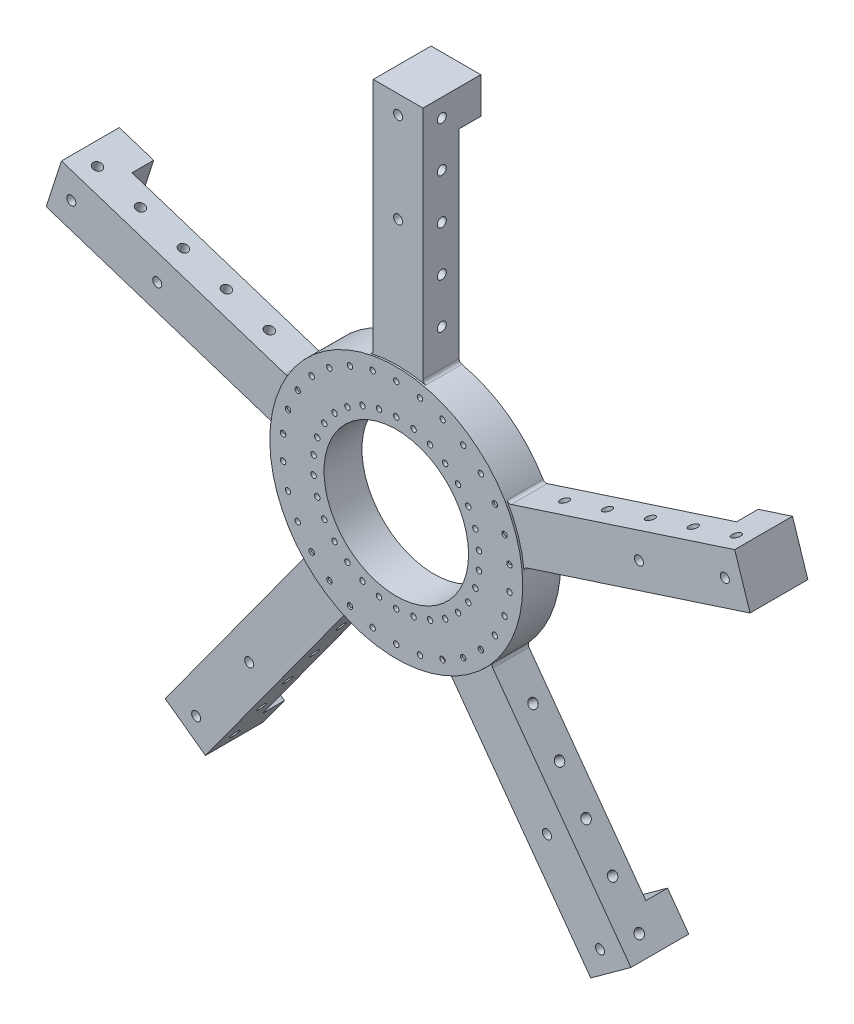
from build123d import *

# Parameters (mm, degrees)
SKETCH1_R                   = 700
SKETCH1_R_2                 = 400
BOSS_EXTRUDE1_DEPTH         = 210
BOSS_EXTRUDE2_START         = 560
SKETCH2_W                   = 275
SKETCH2_H                   = 200
BOSS_EXTRUDE2_DEPTH         = 1443.6
SKETCH3_W                   = 275
SKETCH3_H                   = 200
BOSS_EXTRUDE3_DEPTH         = 120
SKETCH4_R                   = 15
CUT_EXTRUDE1_DEPTH          = 75
CIRPATTERN1_COUNT           = 30
SKETCH6_R                   = 25
CUT_EXTRUDE3_DEPTH          = 75
SKETCH5_R                   = 25
CUT_EXTRUDE2_DEPTH          = 75
FILLET1_R                   = 20
CIRPATTERN2_COUNT           = 5
CIRPATTERN2_COPY_1_SKETCH_R = 25
CIRPATTERN2_COPY_1_DEPTH    = 75
CIRPATTERN2_COPY_2_SKETCH_R = 25
CIRPATTERN2_COPY_2_DEPTH    = 75
CIRPATTERN2_COPY_3_SKETCH_R = 25
CIRPATTERN2_COPY_3_DEPTH    = 75
CIRPATTERN2_COPY_4_SKETCH_R = 25
CIRPATTERN2_COPY_4_DEPTH    = 75
FILLET1_OF_CIRPATTERN2_R    = 20


with BuildPart() as part:
    # Sketch1 → Boss-Extrude1 (new body)
    with BuildSketch(Plane.XY):
        Circle(SKETCH1_R)
        Circle(SKETCH1_R_2, mode=Mode.SUBTRACT)
    extrude(amount=BOSS_EXTRUDE1_DEPTH)

    # Sketch2 → Boss-Extrude2 (add)
    with BuildSketch(Plane(origin=(0, 0, 0), x_dir=(1, 0, 0), z_dir=(0, 1, 0)).offset(BOSS_EXTRUDE2_START)):
        with Locations((0, -100)):
            Rectangle(SKETCH2_W, SKETCH2_H)
    boss_extrude2 = extrude(amount=BOSS_EXTRUDE2_DEPTH)

    # Sketch3 → Boss-Extrude3 (add)
    with BuildSketch(Plane(origin=(0, 0, 0), x_dir=(-1, 0, 0), z_dir=(0, 0, -1))):
        with Locations((0, 1903.6)):
            Rectangle(SKETCH3_W, SKETCH3_H)
    boss_extrude3 = extrude(amount=BOSS_EXTRUDE3_DEPTH)

    # Sketch4 → Cut-Extrude1 (cut)
    with BuildSketch(Plane.XY.offset(210)):
        with Locations((0, 630)):
            Circle(SKETCH4_R)
        with Locations((0, 460)):
            Circle(SKETCH4_R)
    cut_extrude1 = extrude(amount=-CUT_EXTRUDE1_DEPTH, mode=Mode.SUBTRACT)

    # CirPattern1: Cut-Extrude1 ×30 about axis
    cirpattern1_axis = Axis((0, 0, 0), (0, 0, 1))
    for i in range(1, CIRPATTERN1_COUNT):
        add(cut_extrude1.rotate(cirpattern1_axis, i * 360 / CIRPATTERN1_COUNT), mode=Mode.SUBTRACT)

    # Sketch6 → Cut-Extrude3 (cut)
    with BuildSketch(Plane.ZY.offset(137.5)):
        with Locations((95.755617534, 1903.6)):
            Circle(SKETCH6_R)
        with Locations((95.755617534, 1653.6)):
            Circle(SKETCH6_R)
        with Locations((95.755617534, 1403.6)):
            Circle(SKETCH6_R)
        with Locations((95.755617534, 1153.6)):
            Circle(SKETCH6_R)
        with Locations((95.755617534, 903.6)):
            Circle(SKETCH6_R)
    cut_extrude3 = extrude(amount=-CUT_EXTRUDE3_DEPTH, mode=Mode.SUBTRACT)

    # Sketch5 → Cut-Extrude2 (cut)
    with BuildSketch(Plane.XY.offset(200)):
        with Locations((0, 1901.586149553)):
            Circle(SKETCH5_R)
        with Locations((0, 1401.643397042)):
            Circle(SKETCH5_R)
    cut_extrude2 = extrude(amount=-CUT_EXTRUDE2_DEPTH, mode=Mode.SUBTRACT)

    # Mirror1: Cut-Extrude3 across plane
    add(cut_extrude3.mirror(Plane(origin=(0, 0, 0), x_dir=(0, 0, 1), z_dir=(1, 0, 0))), mode=Mode.SUBTRACT)

    # Fillet1
    fillet1_edges = [part.edges().sort_by_distance(p)[0] for p in [
        (-137.5, 686.362695665, 100),
        (137.5, 686.362695665, 100),
    ]]
    fillet(fillet1_edges, radius=FILLET1_R)

    # CirPattern2: Boss-Extrude2, Boss-Extrude3, Cut-Extrude3, Cut-Extrude2 ×5 about axis
    cirpattern2_axis = Axis((0, 0, 0), (0, 0, 1))
    add([boss_extrude2.rotate(cirpattern2_axis, i * 360 / CIRPATTERN2_COUNT) for i in range(1, CIRPATTERN2_COUNT)])
    add([boss_extrude3.rotate(cirpattern2_axis, i * 360 / CIRPATTERN2_COUNT) for i in range(1, CIRPATTERN2_COUNT)])
    add([cut_extrude3.rotate(cirpattern2_axis, i * 360 / CIRPATTERN2_COUNT) for i in range(1, CIRPATTERN2_COUNT)], mode=Mode.SUBTRACT)
    add([cut_extrude2.rotate(cirpattern2_axis, i * 360 / CIRPATTERN2_COUNT) for i in range(1, CIRPATTERN2_COUNT)], mode=Mode.SUBTRACT)

    # CirPattern2 copy 1 sketch → CirPattern2 copy 1 (cut)
    with BuildSketch(Plane(origin=(42.489836727, 130.770270991, 0), x_dir=(0, 0, 1), z_dir=(0.30901699437494745, 0.9510565162951535, 0))):
        with Locations((95.755617534, -1903.6)):
            Circle(CIRPATTERN2_COPY_1_SKETCH_R)
        with Locations((95.755617534, -1653.6)):
            Circle(CIRPATTERN2_COPY_1_SKETCH_R)
        with Locations((95.755617534, -1403.6)):
            Circle(CIRPATTERN2_COPY_1_SKETCH_R)
        with Locations((95.755617534, -1153.6)):
            Circle(CIRPATTERN2_COPY_1_SKETCH_R)
        with Locations((95.755617534, -903.6)):
            Circle(CIRPATTERN2_COPY_1_SKETCH_R)
    extrude(amount=-CIRPATTERN2_COPY_1_DEPTH, mode=Mode.SUBTRACT)

    # CirPattern2 copy 2 sketch → CirPattern2 copy 2 (cut)
    with BuildSketch(Plane(origin=(-111.239836727, 80.82047219, 0), x_dir=(0, 0, 1), z_dir=(-0.8090169943749473, 0.5877852522924732, 0))):
        with Locations((95.755617534, -1903.6)):
            Circle(CIRPATTERN2_COPY_2_SKETCH_R)
        with Locations((95.755617534, -1653.6)):
            Circle(CIRPATTERN2_COPY_2_SKETCH_R)
        with Locations((95.755617534, -1403.6)):
            Circle(CIRPATTERN2_COPY_2_SKETCH_R)
        with Locations((95.755617534, -1153.6)):
            Circle(CIRPATTERN2_COPY_2_SKETCH_R)
        with Locations((95.755617534, -903.6)):
            Circle(CIRPATTERN2_COPY_2_SKETCH_R)
    extrude(amount=-CIRPATTERN2_COPY_2_DEPTH, mode=Mode.SUBTRACT)

    # CirPattern2 copy 3 sketch → CirPattern2 copy 3 (cut)
    with BuildSketch(Plane(origin=(-111.239836727, -80.82047219, 0), x_dir=(0, 0, 1), z_dir=(-0.8090169943749476, -0.587785252292473, 0))):
        with Locations((95.755617534, -1903.6)):
            Circle(CIRPATTERN2_COPY_3_SKETCH_R)
        with Locations((95.755617534, -1653.6)):
            Circle(CIRPATTERN2_COPY_3_SKETCH_R)
        with Locations((95.755617534, -1403.6)):
            Circle(CIRPATTERN2_COPY_3_SKETCH_R)
        with Locations((95.755617534, -1153.6)):
            Circle(CIRPATTERN2_COPY_3_SKETCH_R)
        with Locations((95.755617534, -903.6)):
            Circle(CIRPATTERN2_COPY_3_SKETCH_R)
    extrude(amount=-CIRPATTERN2_COPY_3_DEPTH, mode=Mode.SUBTRACT)

    # CirPattern2 copy 4 sketch → CirPattern2 copy 4 (cut)
    with BuildSketch(Plane(origin=(42.489836727, -130.770270991, 0), x_dir=(0, 0, 1), z_dir=(0.30901699437494723, -0.9510565162951536, 0))):
        with Locations((95.755617534, -1903.6)):
            Circle(CIRPATTERN2_COPY_4_SKETCH_R)
        with Locations((95.755617534, -1653.6)):
            Circle(CIRPATTERN2_COPY_4_SKETCH_R)
        with Locations((95.755617534, -1403.6)):
            Circle(CIRPATTERN2_COPY_4_SKETCH_R)
        with Locations((95.755617534, -1153.6)):
            Circle(CIRPATTERN2_COPY_4_SKETCH_R)
        with Locations((95.755617534, -903.6)):
            Circle(CIRPATTERN2_COPY_4_SKETCH_R)
    extrude(amount=-CIRPATTERN2_COPY_4_DEPTH, mode=Mode.SUBTRACT)

    # Fillet1 of CirPattern2
    fillet1_of_cirpattern2_edges = [part.edges().sort_by_distance(p)[0] for p in [
        (-695.25955098, 81.327466275, 100),
        (-610.279877527, 342.868008256, 100),
        (-292.194033509, -636.099557288, 100),
        (-514.673706962, -474.458612907, 100),
        (514.673706962, -474.458612907, 100),
        (292.194033509, -636.099557288, 100),
        (610.279877527, 342.868008256, 100),
        (695.25955098, 81.327466275, 100),
    ]]
    fillet(fillet1_of_cirpattern2_edges, radius=FILLET1_OF_CIRPATTERN2_R)


solid = part.part
